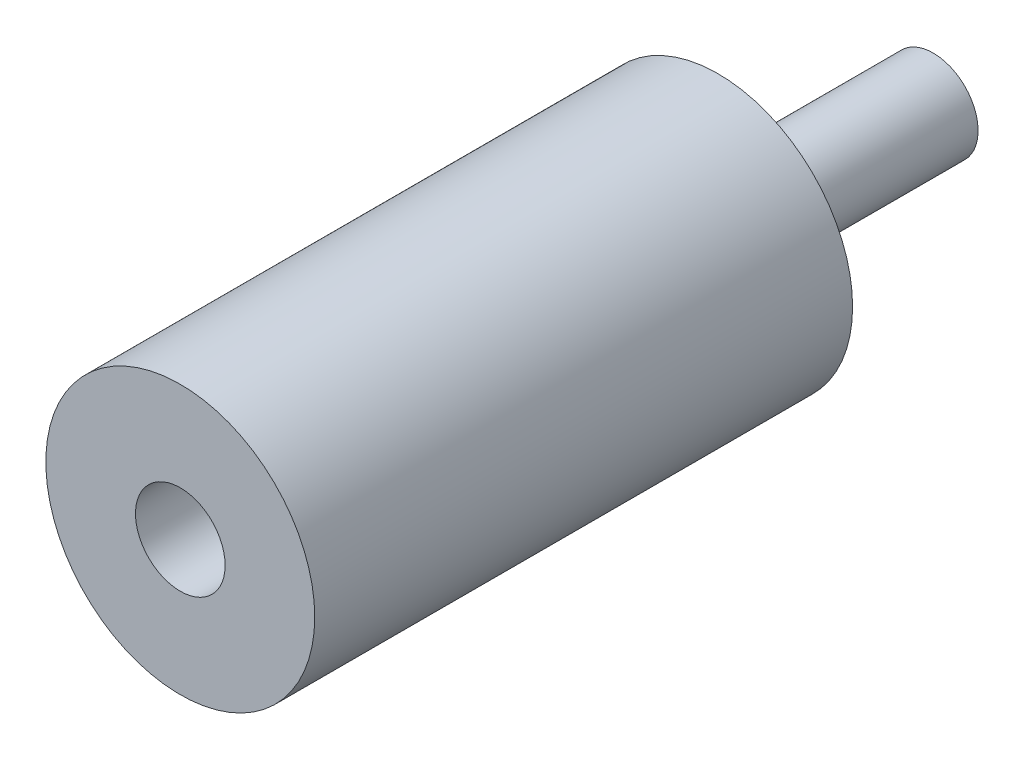
from build123d import *

# Parameters (mm, degrees)
SKETCH_1_R          = 7.5
EXTRUDE_1_DEPTH     = 30
SKETCH_2_R          = 2.5
EXTRUDE_2_DEPTH     = 12
SKETCH_3_R          = 2.5
CUT_EXTRUDE_1_DEPTH = 5


with BuildPart() as part:
    # 草图1 → 凸台-拉伸1 (new body)
    with BuildSketch(Plane.XY):
        Circle(SKETCH_1_R)
    extrude(amount=EXTRUDE_1_DEPTH)

    # 草图2 → 凸台-拉伸2 (add)
    with BuildSketch(Plane(origin=(0, 0, 0), x_dir=(-1, 0, 0), z_dir=(0, 0, -1))):
        Circle(SKETCH_2_R)
    extrude(amount=EXTRUDE_2_DEPTH)

    # 草图3 → 切除-拉伸1 (cut)
    with BuildSketch(Plane.XY.offset(30)):
        with Locations(Location((0, 0, 0), (0, 0, 180))):
            Circle(SKETCH_3_R)
    extrude(amount=-CUT_EXTRUDE_1_DEPTH, mode=Mode.SUBTRACT)


solid = part.part
